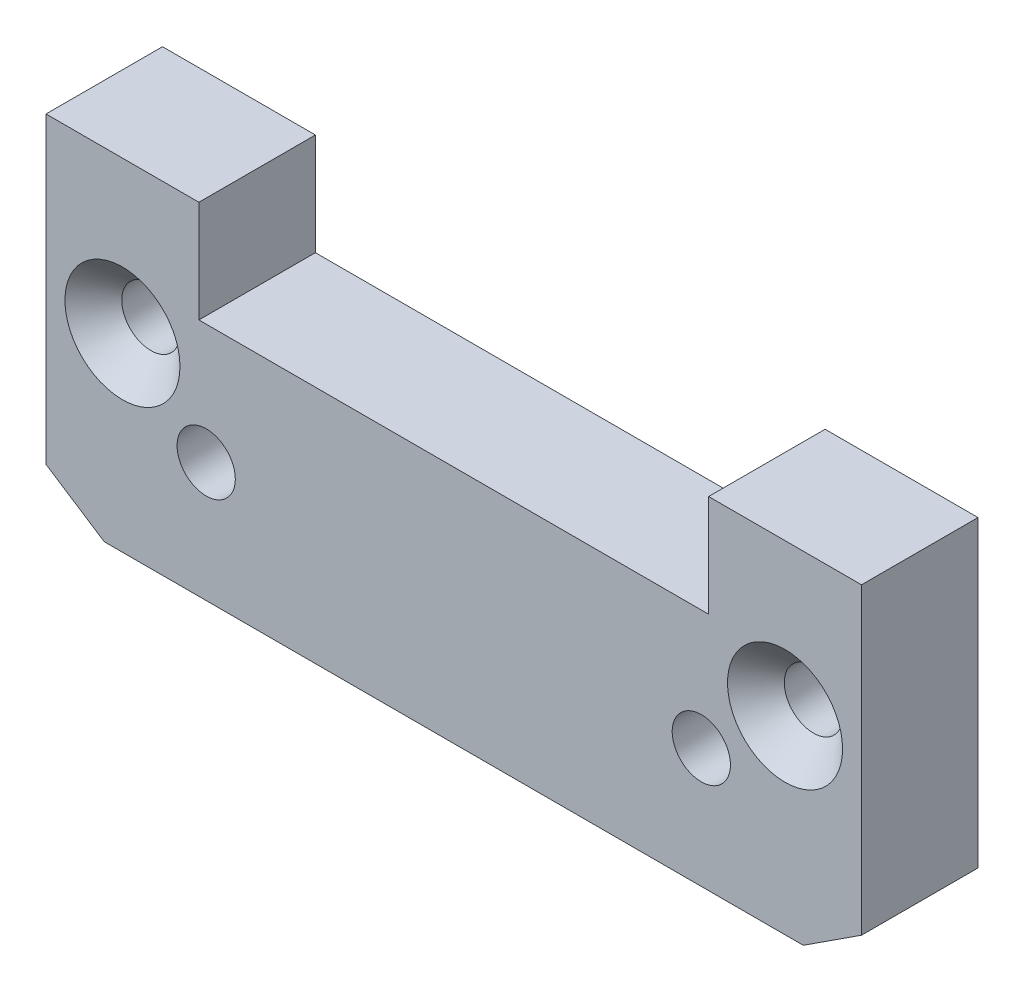
from build123d import *

# Parameters (mm, degrees)
BOSS_EXTRUDE1_DEPTH           = 8
CSK_FOR_M4_SFHCS1_D           = 4
CSK_FOR_M4_SFHCS1_DEPTH       = 13
CSK_FOR_M4_SFHCS1_CSINK_D     = 7.9
CSK_FOR_M4_SFHCS1_CSINK_ANGLE = 90
CSK_FOR_M4_SFHCS1_TIP         = 1.201721238
CSK_FOR_M4_SFHCS2_D           = 4
CSK_FOR_M4_SFHCS2_DEPTH       = 16
CSK_FOR_M4_SFHCS2_CSINK_D     = 7.9
CSK_FOR_M4_SFHCS2_CSINK_ANGLE = 90
CSK_FOR_M4_SFHCS2_TIP         = 1.201721238


with BuildPart() as part:
    # Sketch1 → Boss-Extrude1 (new body)
    with BuildSketch(Plane.XY):
        Polygon((28, 0), (28, 10), (17.5, 10), (17.5, 3), (-17.5, 3), (-17.5, 10), (-28, 10), (-28, 0), (-28, -10.842369627), (-24, -13.44), (24, -13.44), (28, -10.842369627), align=None)
    extrude(amount=BOSS_EXTRUDE1_DEPTH)

    # CSK for M4 SFHCS1
    with Locations(Plane(origin=(-695.683007616, 1385.247292614, 13), x_dir=(1, 0, 0), z_dir=(0, 0, 1))):
        with Locations((678.683007616, -1390.467292614), (712.683007616, -1390.467292614)):
            CounterSinkHole(CSK_FOR_M4_SFHCS1_D / 2, CSK_FOR_M4_SFHCS1_CSINK_D / 2, depth=CSK_FOR_M4_SFHCS1_DEPTH, counter_sink_angle=CSK_FOR_M4_SFHCS1_CSINK_ANGLE)
            with Locations((0, 0, -(CSK_FOR_M4_SFHCS1_DEPTH + CSK_FOR_M4_SFHCS1_TIP / 2))):  # 118° drill point
                Cone(0, CSK_FOR_M4_SFHCS1_D / 2, CSK_FOR_M4_SFHCS1_TIP, mode=Mode.SUBTRACT)

    # CSK for M4 SFHCS2
    with Locations(Plane(origin=(-695.683007616, 1385.247292614, 8), x_dir=(1, 0, 0), z_dir=(0, 0, 1))):
        with Locations((672.933007616, -1385.668477427), (718.433007616, -1385.668477427)):
            CounterSinkHole(CSK_FOR_M4_SFHCS2_D / 2, CSK_FOR_M4_SFHCS2_CSINK_D / 2, depth=CSK_FOR_M4_SFHCS2_DEPTH, counter_sink_angle=CSK_FOR_M4_SFHCS2_CSINK_ANGLE)
            with Locations((0, 0, -(CSK_FOR_M4_SFHCS2_DEPTH + CSK_FOR_M4_SFHCS2_TIP / 2))):  # 118° drill point
                Cone(0, CSK_FOR_M4_SFHCS2_D / 2, CSK_FOR_M4_SFHCS2_TIP, mode=Mode.SUBTRACT)


solid = part.part
